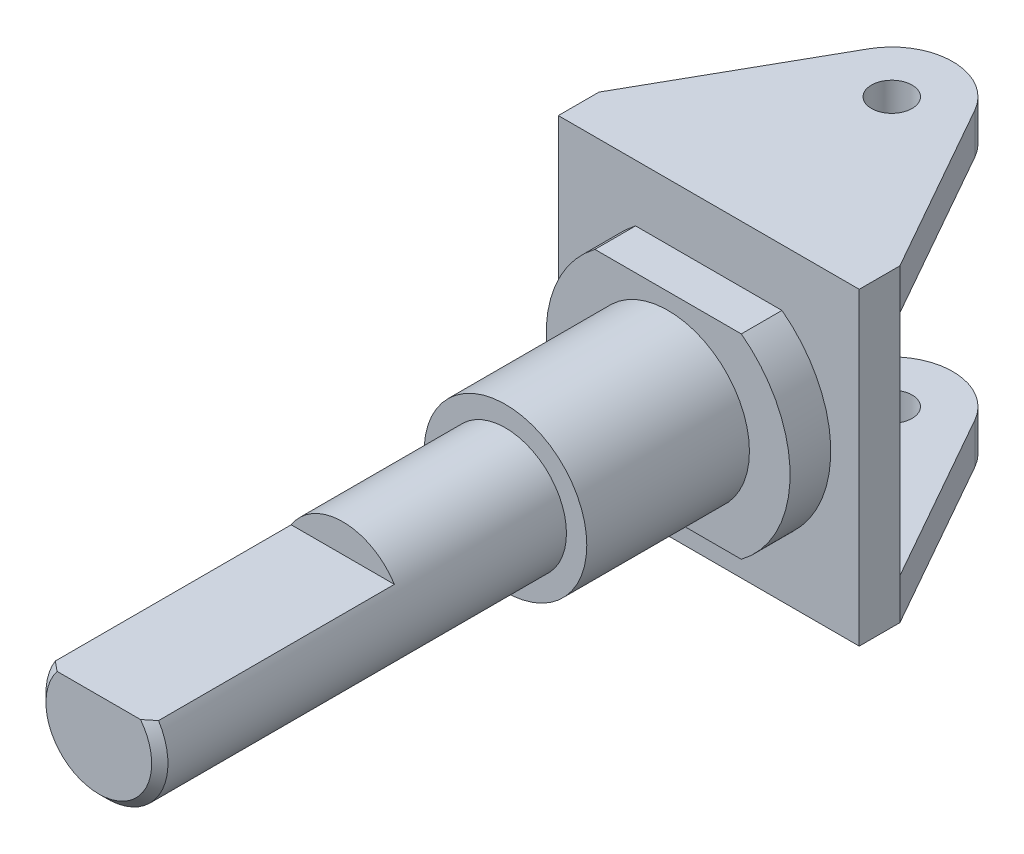
from build123d import *

# Parameters (mm, degrees)
SKETCH1_W                      = 74
SKETCH1_H                      = 56
BOSS_EXTRUDE1_DEPTH            = 10
BOSS_EXTRUDE2_DEPTH            = 10
BOSS_EXTRUDE3_START            = 10
BOSS_EXTRUDE3_DEPTH            = 10
BOSS_EXTRUDE4_DEPTH            = 10
SKETCH5_R                      = 20
BOSS_EXTRUDE5_DEPTH            = 40
SKETCH6_R                      = 15
BOSS_EXTRUDE6_DEPTH            = 100
CUT_EXTRUDE1_START             = -60
CUT_EXTRUDE1_DEPTH             = 60
F_10_0_10_DIAMETER_HOLE1_D     = 10
F_10_0_10_DIAMETER_HOLE1_DEPTH = 10
F_10_0_10_DIAMETER_HOLE2_D     = 10
F_10_0_10_DIAMETER_HOLE2_DEPTH = 76
CHAMFER1_SIZE                  = 2


with BuildPart() as part:
    # Sketch1 → Boss-Extrude1 (new body)
    with BuildSketch(Plane.XY):
        Rectangle(SKETCH1_W, SKETCH1_H)
    extrude(amount=-BOSS_EXTRUDE1_DEPTH)

    # Sketch2 → Boss-Extrude2 (add)
    with BuildSketch(Plane.XZ.offset(28)):
        with BuildLine():
            Line((-37, 0), (37, 0))
            Line((37, 0), (37, -10))
            Line((37, -10), (13.060137394, -52.377859531))
            ThreePointArc((13.060137394, -52.377859531), (0, -60), (-13.060137394, -52.377859531))
            Line((-13.060137394, -52.377859531), (-37, -10))
            Line((-37, -10), (-37, 0))
        make_face()
    extrude(amount=BOSS_EXTRUDE2_DEPTH)

    # Sketch3 → Boss-Extrude3 (add)
    with BuildSketch(Plane(origin=(0, 28, 0), x_dir=(-1, 0, 0), z_dir=(0, 1, 0)).offset(BOSS_EXTRUDE3_START)):
        with BuildLine():
            Line((-37, 0), (37, 0))
            Line((37, 0), (37, -10))
            Line((37, -10), (13.060137394, -52.377859531))
            ThreePointArc((13.060137394, -52.377859531), (0, -60), (-13.060137394, -52.377859531))
            Line((-13.060137394, -52.377859531), (-37, -10))
            Line((-37, -10), (-37, 0))
        make_face()
    extrude(amount=-BOSS_EXTRUDE3_DEPTH)

    # Sketch4 → Boss-Extrude4 (add)
    with BuildSketch(Plane.XY):
        with BuildLine():
            Line((18, -24), (-18, -24))
            ThreePointArc((-18, -24), (-30, 0), (-18, 24))
            Line((-18, 24), (18, 24))
            ThreePointArc((18, 24), (30, 0), (18, -24))
        make_face()
    extrude(amount=BOSS_EXTRUDE4_DEPTH)

    # Sketch5 → Boss-Extrude5 (add)
    with BuildSketch(Plane.XY.offset(10)):
        Circle(SKETCH5_R)
    extrude(amount=BOSS_EXTRUDE5_DEPTH)

    # Sketch6 → Boss-Extrude6 (add)
    with BuildSketch(Plane.XY.offset(50)):
        with Locations(Location((0, 0, 0), (0, 0, 180))):
            Circle(SKETCH6_R)
    extrude(amount=BOSS_EXTRUDE6_DEPTH)

    # Sketch7 → Cut-Extrude1 (cut)
    with BuildSketch(Plane.XY.offset(150).offset(CUT_EXTRUDE1_START)):
        with BuildLine():
            Line((-12.68857754, 8), (12.68857754, 8))
            ThreePointArc((12.68857754, 8), (0, 15), (-12.68857754, 8))
        make_face()
    extrude(amount=CUT_EXTRUDE1_DEPTH, mode=Mode.SUBTRACT)

    # Ø10.0 (10) Diameter Hole1
    with Locations(Plane(origin=(0, -38, 0), x_dir=(-1, 0, 0), z_dir=(0, -1, 0))):
        with Locations((0, 45)):
            Hole(F_10_0_10_DIAMETER_HOLE1_D / 2, depth=F_10_0_10_DIAMETER_HOLE1_DEPTH)

    # Ø10.0 (10) Diameter Hole2
    with Locations(Plane(origin=(0, 38, 0), x_dir=(1, 0, 0), z_dir=(0, 1, 0))):
        with Locations((0, 45)):
            Hole(F_10_0_10_DIAMETER_HOLE2_D / 2, depth=F_10_0_10_DIAMETER_HOLE2_DEPTH)

    # Chamfer1
    chamfer1_edges = [part.edges().sort_by_distance(p)[0] for p in [
        (4.163612428, -14.410563193, 150),
    ]]
    chamfer(chamfer1_edges, length=CHAMFER1_SIZE)


solid = part.part
